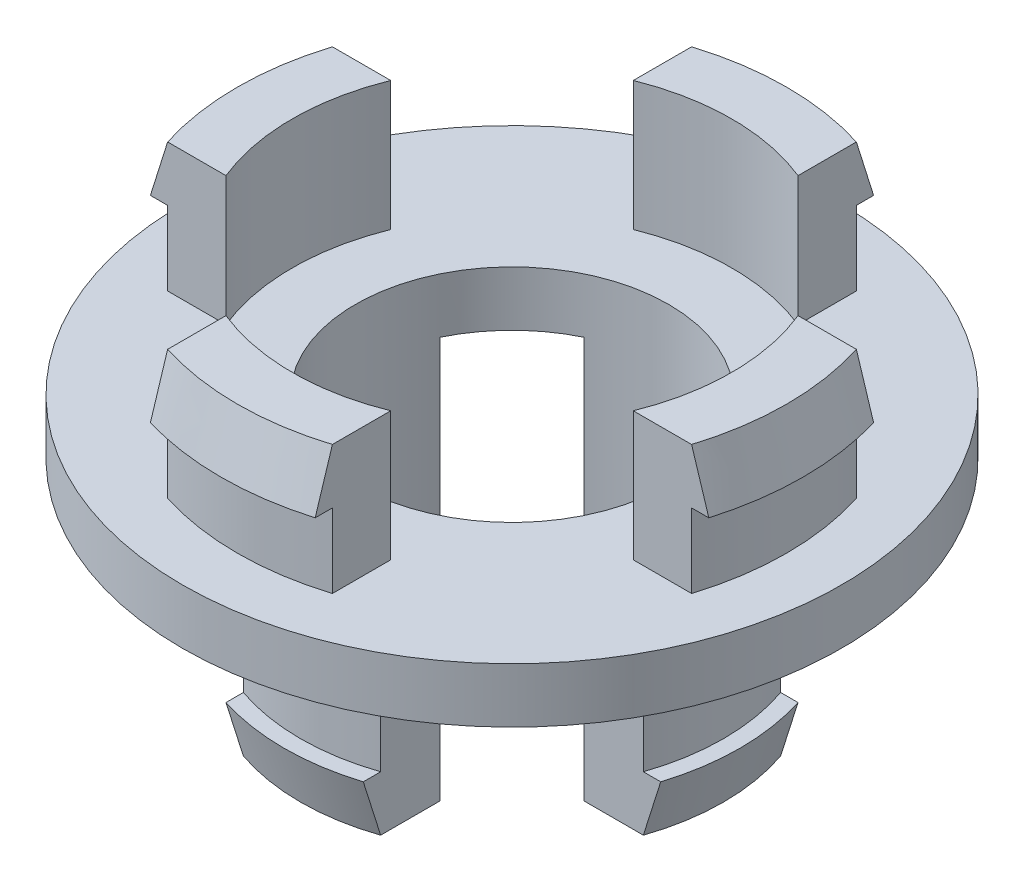
from build123d import *

# Parameters (mm, degrees)
CUT_EXTRUDE1_REACH = 29.699
CUT_EXTRUDE2_REACH = 29.699


with BuildPart() as part:
    # Sketch1 → Revolve1 (revolve)
    with BuildSketch(Plane.XY, mode=Mode.PRIVATE) as revolve1_sk:
        Polygon((12.7, 17.399), (13.462, 14.859), (12.7, 14.859), (12.7, 11.43), (15.24, 11.43), (15.24, 8.89), (9.779, 8.89), (9.779, 2.54), (10.541, 2.54), (9.779, 0), (7.239, 0), (7.239, 11.43), (10.16, 11.43), (10.16, 17.399), align=None)
    revolve(revolve1_sk.sketch.rotate(Axis((0, 0, 0), (0, 1, 0)), 90), axis=Axis((0, 0, 0), (0, 1, 0)))

    # Cut-Extrude1: up to this face of the body (flat: up to its plane)
    cut_extrude1_end = Plane(part.part.faces().sort_by_distance((0, 11.43, 13.131052294))[0])
    # Sketch2 → Cut-Extrude1 (cut, up to the picked face)
    with BuildSketch(Plane(origin=(0, 17.399, 0), x_dir=(1, 0, 0), z_dir=(0, 1, 0)), mode=Mode.PRIVATE) as cut_extrude1_sk1:
        with BuildLine():
            Line((-9.418572079, 3.81), (-12.911597268, 3.81))
            ThreePointArc((-12.911597268, 3.81), (-9.519071488, 9.519071488), (-3.81, 12.911597268))
            Line((-3.81, 12.911597268), (-3.81, 9.418572079))
            ThreePointArc((-3.81, 9.418572079), (-7.184204897, 7.184204897), (-9.418572079, 3.81))
        make_face()
    cut_extrude1_tool1 = split(extrude(cut_extrude1_sk1.sketch, amount=-CUT_EXTRUDE1_REACH, mode=Mode.PRIVATE), bisect_by=cut_extrude1_end, keep=Keep.BOTH, mode=Mode.PRIVATE)
    # Sketch2 → Cut-Extrude1 (cut, up to the picked face)
    with BuildSketch(Plane(origin=(0, 17.399, 0), x_dir=(1, 0, 0), z_dir=(0, 1, 0)), mode=Mode.PRIVATE) as cut_extrude1_sk2:
        with BuildLine():
            Line((-12.911597268, -3.81), (-9.418572079, -3.81))
            ThreePointArc((-9.418572079, -3.81), (-7.184204897, -7.184204897), (-3.81, -9.418572079))
            Line((-3.81, -9.418572079), (-3.81, -12.911597268))
            ThreePointArc((-3.81, -12.911597268), (-9.519071488, -9.519071488), (-12.911597268, -3.81))
        make_face()
    cut_extrude1_tool2 = split(extrude(cut_extrude1_sk2.sketch, amount=-CUT_EXTRUDE1_REACH, mode=Mode.PRIVATE), bisect_by=cut_extrude1_end, keep=Keep.BOTH, mode=Mode.PRIVATE)
    # Sketch2 → Cut-Extrude1 (cut, up to the picked face)
    with BuildSketch(Plane(origin=(0, 17.399, 0), x_dir=(1, 0, 0), z_dir=(0, 1, 0)), mode=Mode.PRIVATE) as cut_extrude1_sk3:
        with BuildLine():
            Line((3.81, 9.418572079), (3.81, 12.911597268))
            ThreePointArc((3.81, 12.911597268), (9.519071488, 9.519071488), (12.911597268, 3.81))
            Line((12.911597268, 3.81), (9.418572079, 3.81))
            ThreePointArc((9.418572079, 3.81), (7.184204897, 7.184204897), (3.81, 9.418572079))
        make_face()
    cut_extrude1_tool3 = split(extrude(cut_extrude1_sk3.sketch, amount=-CUT_EXTRUDE1_REACH, mode=Mode.PRIVATE), bisect_by=cut_extrude1_end, keep=Keep.BOTH, mode=Mode.PRIVATE)
    # Sketch2 → Cut-Extrude1 (cut, up to the picked face)
    with BuildSketch(Plane(origin=(0, 17.399, 0), x_dir=(1, 0, 0), z_dir=(0, 1, 0)), mode=Mode.PRIVATE) as cut_extrude1_sk4:
        with BuildLine():
            Line((9.418572079, -3.81), (12.911597268, -3.81))
            ThreePointArc((12.911597268, -3.81), (9.519071488, -9.519071488), (3.81, -12.911597268))
            Line((3.81, -12.911597268), (3.81, -9.418572079))
            ThreePointArc((3.81, -9.418572079), (7.184204897, -7.184204897), (9.418572079, -3.81))
        make_face()
    cut_extrude1_tool4 = split(extrude(cut_extrude1_sk4.sketch, amount=-CUT_EXTRUDE1_REACH, mode=Mode.PRIVATE), bisect_by=cut_extrude1_end, keep=Keep.BOTH, mode=Mode.PRIVATE)
    add(cut_extrude1_tool1.solids().sort_by(Axis((-8.150135, 17.399, -8.150135), (0, -1, 0)))[0], mode=Mode.SUBTRACT)
    add(cut_extrude1_tool2.solids().sort_by(Axis((-8.150135, 17.399, 8.150135), (0, -1, 0)))[0], mode=Mode.SUBTRACT)
    add(cut_extrude1_tool3.solids().sort_by(Axis((8.150135, 17.399, -8.150135), (0, -1, 0)))[0], mode=Mode.SUBTRACT)
    add(cut_extrude1_tool4.solids().sort_by(Axis((8.150135, 17.399, 8.150135), (0, -1, 0)))[0], mode=Mode.SUBTRACT)

    # Cut-Extrude2: up to this face of the body (flat: up to its plane)
    cut_extrude2_end = Plane(part.part.faces().sort_by_distance((0, 8.89, 14.808947706))[0])
    # Sketch3 → Cut-Extrude2 (cut, up to the picked face)
    with BuildSketch(Plane.XZ, mode=Mode.PRIVATE) as cut_extrude2_sk1:
        with BuildLine():
            Line((-6.505574225, 3.175), (-10.05147034, 3.175))
            ThreePointArc((-10.05147034, 3.175), (-7.45361258, 7.45361258), (-3.175, 10.05147034))
            Line((-3.175, 10.05147034), (-3.175, 6.505574225))
            ThreePointArc((-3.175, 6.505574225), (-5.118745989, 5.118745989), (-6.505574225, 3.175))
        make_face()
    cut_extrude2_tool1 = split(extrude(cut_extrude2_sk1.sketch, amount=-CUT_EXTRUDE2_REACH, mode=Mode.PRIVATE), bisect_by=cut_extrude2_end, keep=Keep.BOTH, mode=Mode.PRIVATE)
    # Sketch3 → Cut-Extrude2 (cut, up to the picked face)
    with BuildSketch(Plane.XZ, mode=Mode.PRIVATE) as cut_extrude2_sk2:
        with BuildLine():
            Line((-6.505574225, -3.175), (-10.05147034, -3.175))
            ThreePointArc((-10.05147034, -3.175), (-7.45361258, -7.45361258), (-3.175, -10.05147034))
            Line((-3.175, -10.05147034), (-3.175, -6.505574225))
            ThreePointArc((-3.175, -6.505574225), (-5.118745989, -5.118745989), (-6.505574225, -3.175))
        make_face()
    cut_extrude2_tool2 = split(extrude(cut_extrude2_sk2.sketch, amount=-CUT_EXTRUDE2_REACH, mode=Mode.PRIVATE), bisect_by=cut_extrude2_end, keep=Keep.BOTH, mode=Mode.PRIVATE)
    # Sketch3 → Cut-Extrude2 (cut, up to the picked face)
    with BuildSketch(Plane.XZ, mode=Mode.PRIVATE) as cut_extrude2_sk3:
        with BuildLine():
            Line((3.175, 6.505574225), (3.175, 10.05147034))
            ThreePointArc((3.175, 10.05147034), (7.45361258, 7.45361258), (10.05147034, 3.175))
            Line((10.05147034, 3.175), (6.505574225, 3.175))
            ThreePointArc((6.505574225, 3.175), (5.118745989, 5.118745989), (3.175, 6.505574225))
        make_face()
    cut_extrude2_tool3 = split(extrude(cut_extrude2_sk3.sketch, amount=-CUT_EXTRUDE2_REACH, mode=Mode.PRIVATE), bisect_by=cut_extrude2_end, keep=Keep.BOTH, mode=Mode.PRIVATE)
    # Sketch3 → Cut-Extrude2 (cut, up to the picked face)
    with BuildSketch(Plane.XZ, mode=Mode.PRIVATE) as cut_extrude2_sk4:
        with BuildLine():
            Line((6.505574225, -3.175), (10.05147034, -3.175))
            ThreePointArc((10.05147034, -3.175), (7.45361258, -7.45361258), (3.175, -10.05147034))
            Line((3.175, -10.05147034), (3.175, -6.505574225))
            ThreePointArc((3.175, -6.505574225), (5.118745989, -5.118745989), (6.505574225, -3.175))
        make_face()
    cut_extrude2_tool4 = split(extrude(cut_extrude2_sk4.sketch, amount=-CUT_EXTRUDE2_REACH, mode=Mode.PRIVATE), bisect_by=cut_extrude2_end, keep=Keep.BOTH, mode=Mode.PRIVATE)
    add(cut_extrude2_tool1.solids().sort_by(Axis((-6.228446, 0, 6.228446), (0, 1, 0)))[0], mode=Mode.SUBTRACT)
    add(cut_extrude2_tool2.solids().sort_by(Axis((-6.228446, 0, -6.228446), (0, 1, 0)))[0], mode=Mode.SUBTRACT)
    add(cut_extrude2_tool3.solids().sort_by(Axis((6.228446, 0, 6.228446), (0, 1, 0)))[0], mode=Mode.SUBTRACT)
    add(cut_extrude2_tool4.solids().sort_by(Axis((6.228446, 0, -6.228446), (0, 1, 0)))[0], mode=Mode.SUBTRACT)


solid = part.part
